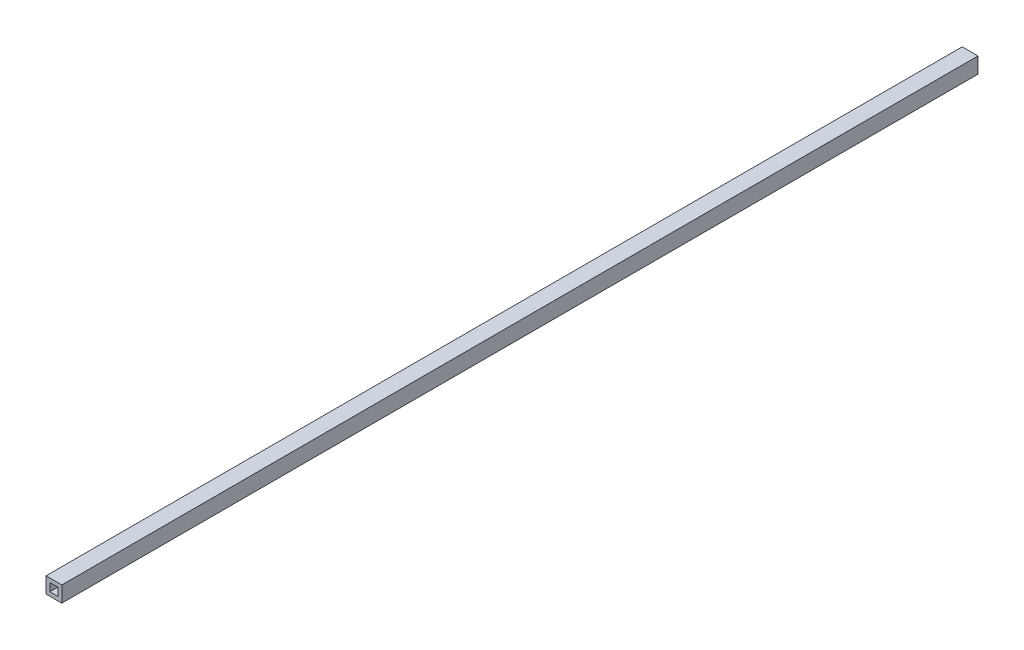
from build123d import *

# Parameters (mm, degrees)
SKETCH1_W           = 20
SKETCH1_H           = 20
SKETCH1_W_2         = 10
SKETCH1_H_2         = 10
EXTRUDE_THIN1_DEPTH = 1160


with BuildPart() as part:
    # Sketch1 → Extrude-Thin1 (new body)
    with BuildSketch(Plane.XY):
        Rectangle(SKETCH1_W, SKETCH1_H)
        Rectangle(SKETCH1_W_2, SKETCH1_H_2, mode=Mode.SUBTRACT)
    extrude(amount=EXTRUDE_THIN1_DEPTH)


solid = part.part
